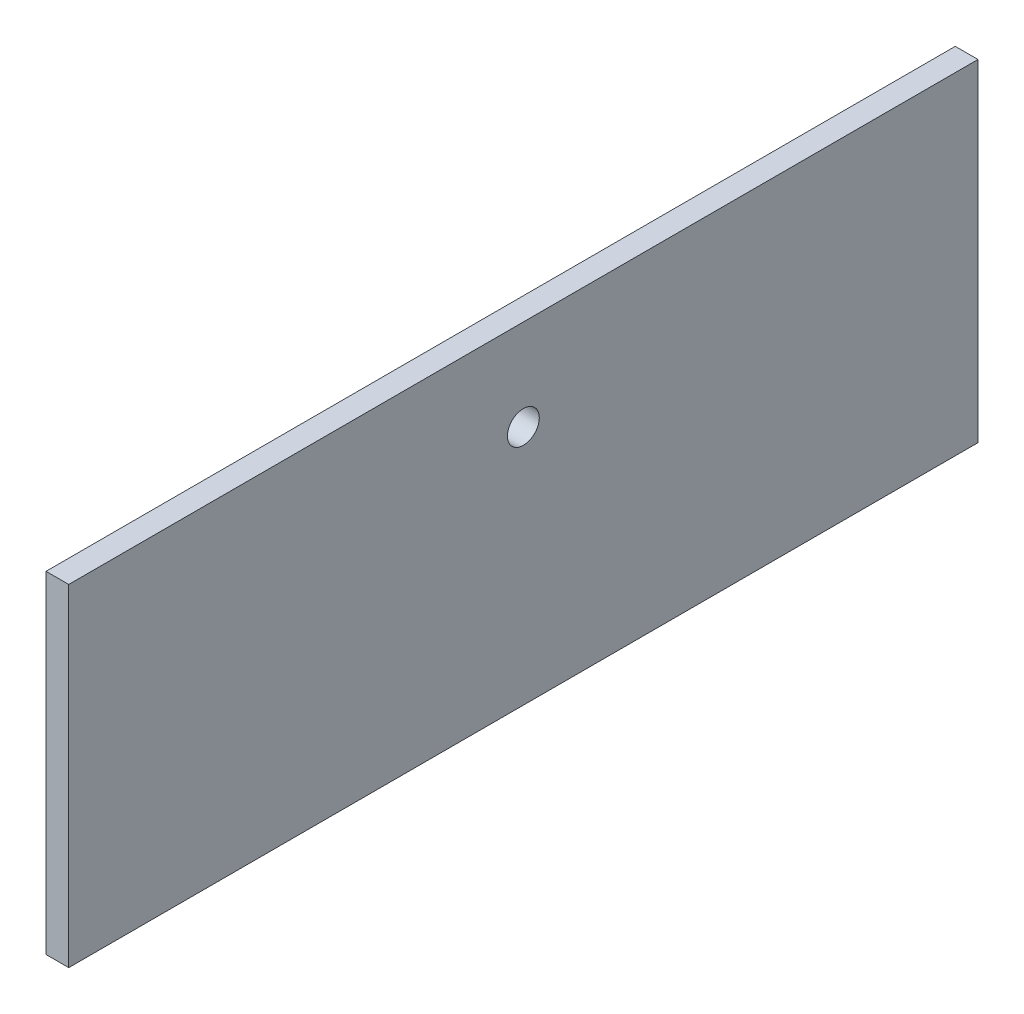
from build123d import *

# Parameters (mm, degrees)
SKETCH1_W           = 150
SKETCH1_H           = 200
BOSS_EXTRUDE1_DEPTH = 100
SHELL2_T            = -5
SKETCH5_R           = 1.9
CUT_EXTRUDE2_DEPTH  = 10
BOSS_EXTRUDE4_DEPTH = 200
SKETCH9_W           = 101.133931545
SKETCH9_H           = 31.996148617
CUT_EXTRUDE4_DEPTH  = 236.849528301
SKETCH10_R          = 4
CUT_EXTRUDE5_DEPTH  = 10
CUT_EXTRUDE7_REACH  = 162.078
SKETCH11_W          = 140
SKETCH11_H          = 5
SKETCH15_R          = 1.2
CUT_EXTRUDE11_DEPTH = 10
SKETCH36_W          = 60
SKETCH36_H          = 5
BOSS_EXTRUDE7_DEPTH = 10
SKETCH37_R          = 3.5
CUT_EXTRUDE15_DEPTH = 60
SKETCH38_R          = 5
CUT_EXTRUDE16_DEPTH = 70
SKETCH42_W          = 159.84088679
SKETCH42_H          = 73
CUT_EXTRUDE20_DEPTH = 236.849528301


with BuildPart() as part:
    # Sketch1 → Boss-Extrude1 (new body)
    with BuildSketch(Plane(origin=(0, 0, 0), x_dir=(1, 0, 0), z_dir=(0, 1, 0))):
        Rectangle(SKETCH1_W, SKETCH1_H)
    extrude(amount=BOSS_EXTRUDE1_DEPTH)

    # Shell2
    shell2_openings = [part.faces().sort_by_distance(p)[0] for p in [
        (0, 50, -100),
        (0, 50, 100),
    ]]
    offset(amount=SHELL2_T, openings=shell2_openings, kind=Kind.INTERSECTION)

    # Sketch5 → Cut-Extrude2 (cut)
    with BuildSketch(Plane.XZ):
        with Locations(Location((-65, 91, 0), (0, 0, 270))):
            Circle(SKETCH5_R)
        with Locations(Location((-35, 91, 0), (0, 0, 270))):
            Circle(SKETCH5_R)
        with Locations(Location((-65, 67, 0), (0, 0, 270))):
            Circle(SKETCH5_R)
        with Locations(Location((-35, 67, 0), (0, 0, 270))):
            Circle(SKETCH5_R)
    cut_extrude2 = extrude(amount=-CUT_EXTRUDE2_DEPTH, mode=Mode.SUBTRACT)

    # Mirror2: Cut-Extrude2 across plane
    add(cut_extrude2.mirror(Plane.XY), mode=Mode.SUBTRACT)

    # Sketch8 → Boss-Extrude4 (add, through all)
    with BuildSketch(Plane.XY.offset(100)):
        Polygon((-15, 17), (75, 17), (75, 22), (-20, 22), (-20, 0), (-15, 0), align=None)
    extrude(amount=-BOSS_EXTRUDE4_DEPTH)

    # Sketch9 → Cut-Extrude4 (cut, through all)
    with BuildSketch(Plane.XY.offset(100)):
        with Locations((35.566965773, 1.001925691)):
            Rectangle(SKETCH9_W, SKETCH9_H)
    extrude(amount=-CUT_EXTRUDE4_DEPTH, mode=Mode.SUBTRACT)

    # Sketch10 → Cut-Extrude5 (cut)
    with BuildSketch(Plane.XZ.offset(-17)):
        with Locations((60, 0)):
            Circle(SKETCH10_R)
    extrude(amount=-CUT_EXTRUDE5_DEPTH, mode=Mode.SUBTRACT)

    # Cut-Extrude7: up to this face of the body (flat: up to its plane)
    cut_extrude7_end = Plane(part.part.faces().sort_by_distance((-44.954220044, 5, 0))[0])
    # Sketch11 → Cut-Extrude7 (cut, up to the picked face)
    with BuildSketch(Plane(origin=(0, 100, 0), x_dir=(1, 0, 0), z_dir=(0, 1, 0)), mode=Mode.PRIVATE) as cut_extrude7_sk1:
        with Locations((0, -92.5)):
            Rectangle(SKETCH11_W, SKETCH11_H)
    cut_extrude7_tool1 = split(extrude(cut_extrude7_sk1.sketch, amount=-CUT_EXTRUDE7_REACH, mode=Mode.PRIVATE), bisect_by=cut_extrude7_end, keep=Keep.BOTH, mode=Mode.PRIVATE)
    cut_extrude7 = cut_extrude7_tool1.solids().sort_by(Axis((0, 100, 92.5), (0, -1, 0)))[0]
    add(cut_extrude7, mode=Mode.SUBTRACT)

    # Mirror3: Cut-Extrude7 across plane
    add(cut_extrude7.mirror(Plane.XY), mode=Mode.SUBTRACT)

    # Sketch15 → Cut-Extrude11 (cut)
    with BuildSketch(Plane(origin=(0, 100, 0), x_dir=(1, 0, 0), z_dir=(0, 1, 0))):
        with Locations(Location((50, 28, 0), (0, 0, 270))):
            Circle(SKETCH15_R)
        with Locations(Location((50, -28, 0), (0, 0, 270))):
            Circle(SKETCH15_R)
        with Locations(Location((-20, 20, 0), (0, 0, 270))):
            Circle(SKETCH15_R)
        with Locations(Location((-20, -20, 0), (0, 0, 270))):
            Circle(SKETCH15_R)
    extrude(amount=-CUT_EXTRUDE11_DEPTH, mode=Mode.SUBTRACT)

    # Sketch36 → Boss-Extrude7 (add)
    with BuildSketch(Plane.ZY.offset(-70)):
        with Locations((-13.202053215, 62.5)):
            Rectangle(SKETCH36_W, SKETCH36_H)
    boss_extrude7 = extrude(amount=BOSS_EXTRUDE7_DEPTH)

    # Mirror5: Boss-Extrude7 across plane
    add(boss_extrude7.mirror(Plane(origin=(0, 0, 0), x_dir=(0, 0, 1), z_dir=(1, 0, 0))))

    # Sketch37 → Cut-Extrude15 (cut)
    with BuildSketch(Plane(origin=(75, 0, 0), x_dir=(0, 0, -1), z_dir=(1, 0, 0))):
        with Locations((0, 75)):
            Circle(SKETCH37_R)
    extrude(amount=-CUT_EXTRUDE15_DEPTH, mode=Mode.SUBTRACT)

    # Sketch38 → Cut-Extrude16 (cut)
    with BuildSketch(Plane.ZY.offset(75)):
        with Locations((0, 80)):
            Circle(SKETCH38_R)
    extrude(amount=-CUT_EXTRUDE16_DEPTH, mode=Mode.SUBTRACT)

    # Sketch42 → Cut-Extrude20 (cut, through all)
    with BuildSketch(Plane.XY.offset(100)):
        with Locations((-9.920443395, 58.5)):
            Rectangle(SKETCH42_W, SKETCH42_H)
        Polygon((-89.84088679, 95), (70, 95), (99.534009441, 95), (99.534009441, 106.078306858), (-89.84088679, 106.078306858), align=None)
        Polygon((106.355095751, 22), (70, 22), (-89.84088679, 22), (-89.84088679, -3.777083183), (106.355095751, -3.777083183), align=None)
    extrude(amount=-CUT_EXTRUDE20_DEPTH, mode=Mode.SUBTRACT)


solid = part.part
